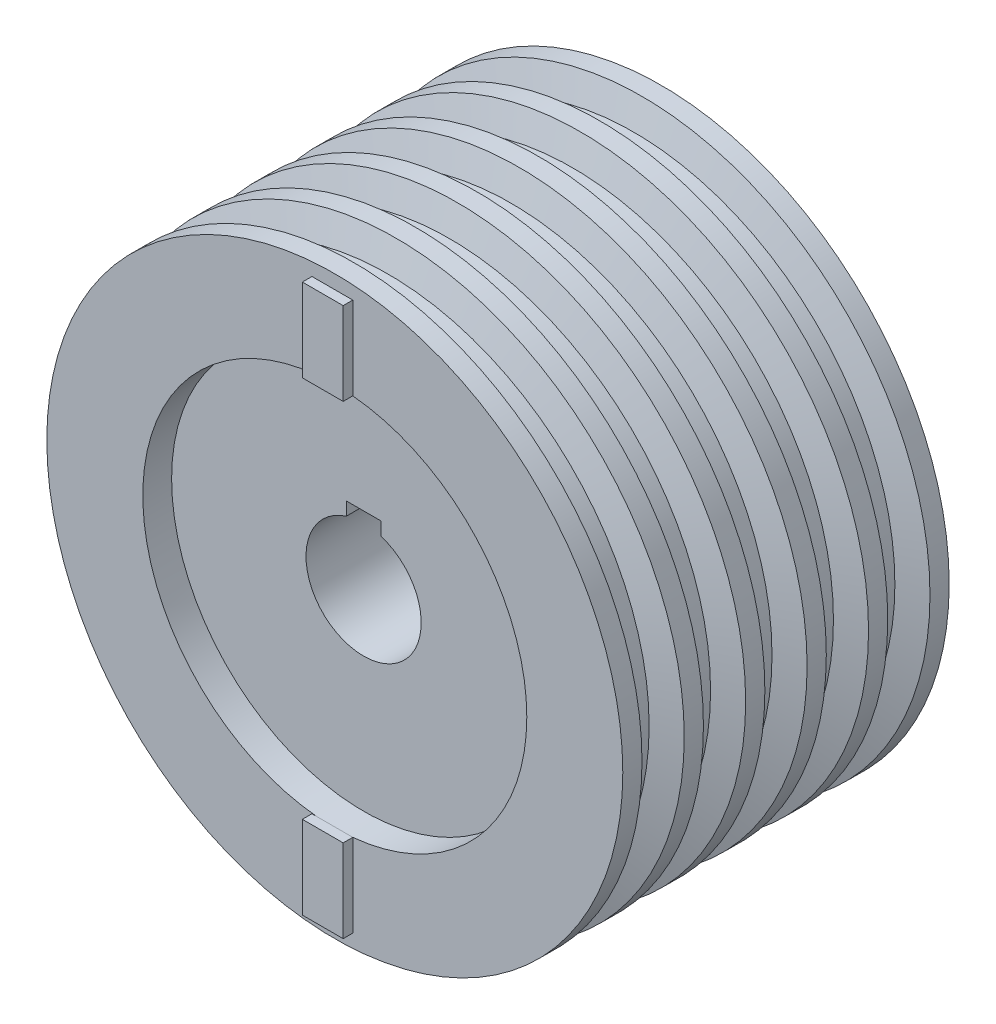
from build123d import *

# Parameters (mm, degrees)
SKETCH1_R           = 150
BOSS_EXTRUDE1_DEPTH = 85
SKETCH3_R           = 30
CUT_EXTRUDE1_DEPTH  = 272.845544381
SKETCH4_R           = 100
SKETCH4_R_2         = 30
CUT_EXTRUDE2_DEPTH  = 15
SKETCH5_W           = 18
SKETCH5_H           = 11
CUT_EXTRUDE3_DEPTH  = 263.726093108
SKETCH10_W          = 21.256971554
SKETCH10_H          = 43.218095202
BOSS_EXTRUDE2_DEPTH = 5


with BuildPart() as part:
    # Sketch1 → Boss-Extrude1 (new, symmetric)
    with BuildSketch(Plane.XY):
        Circle(SKETCH1_R)
    extrude(amount=BOSS_EXTRUDE1_DEPTH, both=True)

    # Sketch3 → Cut-Extrude1 (cut, through all)
    with BuildSketch(Plane.XY.offset(85)):
        Circle(SKETCH3_R)
    extrude(amount=-CUT_EXTRUDE1_DEPTH, mode=Mode.SUBTRACT)

    # Sketch4 → Cut-Extrude2 (cut)
    with BuildSketch(Plane.XY.offset(85)):
        Circle(SKETCH4_R)
        Circle(SKETCH4_R_2, mode=Mode.SUBTRACT)
    cut_extrude2 = extrude(amount=-CUT_EXTRUDE2_DEPTH, mode=Mode.SUBTRACT)

    # Mirror1: Cut-Extrude2 across plane
    add(cut_extrude2.mirror(Plane.XY), mode=Mode.SUBTRACT)

    # Sketch5 → Cut-Extrude3 (cut, through all)
    with BuildSketch(Plane.XY.offset(70)):
        with Locations((0, 30)):
            Rectangle(SKETCH5_W, SKETCH5_H)
    extrude(amount=-CUT_EXTRUDE3_DEPTH, mode=Mode.SUBTRACT)

    # Sketch9 → Cut-Revolve2 (revolve, cut)
    with BuildSketch(Plane(origin=(0, 0, 0), x_dir=(1, 0, 0), z_dir=(0, 1, 0))):
        Polygon((150, 75), (136, 70.71977046), (136, 57.28022954), (150, 53), align=None)
        Polygon((150, 43), (150, 21), (136, 25.28022954), (136, 38.71977046), align=None)
        Polygon((150, 11), (136, 6.71977046), (136, -6.71977046), (150, -11), align=None)
        Polygon((150, -21), (150, -43), (136, -38.71977046), (136, -25.28022954), align=None)
        Polygon((150, -53), (136, -57.28022954), (136, -70.71977046), (150, -75), align=None)
    revolve(axis=Axis((0, 0, 0), (0, 0, -1)), mode=Mode.SUBTRACT)

    # Sketch10 → Boss-Extrude2 (add)
    with BuildSketch(Plane.XY.offset(85)):
        with Locations((-1.274543696, 121.17060528)):
            Rectangle(SKETCH10_W, SKETCH10_H)
        with Locations((-1.274543696, -121.17060528)):
            Rectangle(SKETCH10_W, SKETCH10_H)
    extrude(amount=BOSS_EXTRUDE2_DEPTH)


solid = part.part
